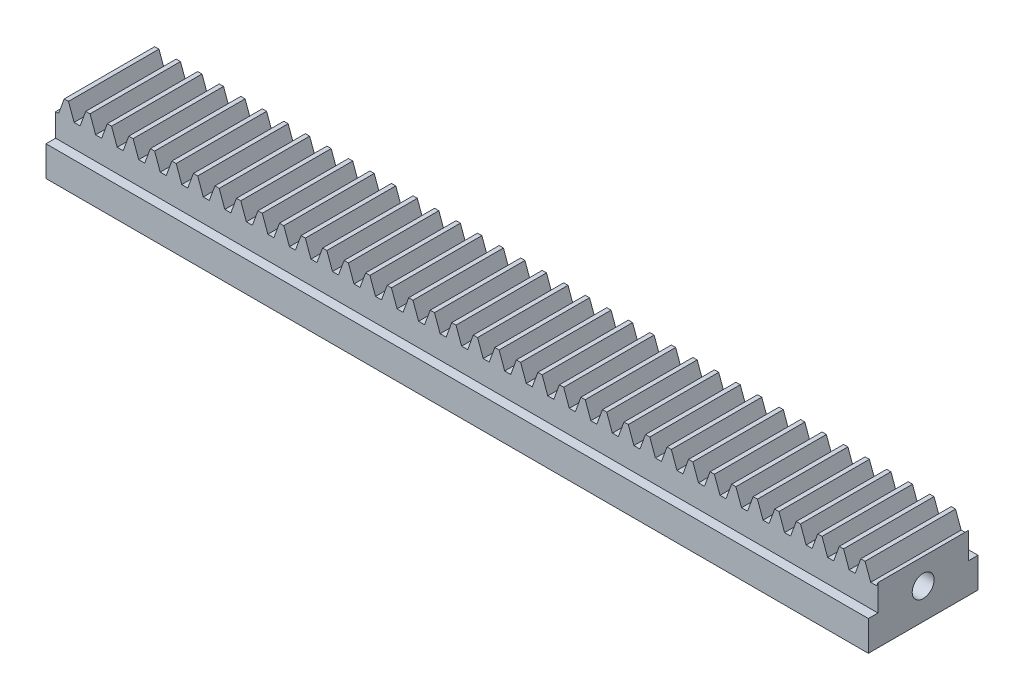
from build123d import *

# Parameters (mm, degrees)
BLANKSKE_W            = 150
BLANKSKE_H            = 12.5
BLANK_DEPTH           = 20
TOOTHCUTSIM_DEPTH     = 152.842846391
TEETHCUTS_COUNT       = 39
TEETHCUTS_PITCH       = 3.926990813
CROQUIS3_W            = 150.577281711
CROQUIS3_H            = 7.352719699
CORTAR_EXTRUIR1_DEPTH = 1.75
CROQUIS4_W            = 150
CROQUIS4_H            = 8.901496228
CORTAR_EXTRUIR2_DEPTH = 1.75
CROQUIS5_R            = 2
CORTAR_EXTRUIR3_DEPTH = 10


with BuildPart() as part:
    # BlankSke → Blank (new body)
    with BuildSketch(Plane.XY):
        with Locations((75, 6.25)):
            Rectangle(BLANKSKE_W, BLANKSKE_H)
    extrude(amount=-BLANK_DEPTH)

    # TooCutSkeSim → ToothCutSim (cut, through all)
    with BuildSketch(Plane.XY):
        Polygon((0.548044212, 9.6875), (-0.548044212, 9.6875), (-1.58095534, 12.5254), (1.58095534, 12.5254), align=None)
    toothcutsim = extrude(amount=-TOOTHCUTSIM_DEPTH, mode=Mode.SUBTRACT)

    # TeethCuts: ToothCutSim ×39
    with Locations(*[(i * TEETHCUTS_PITCH, 0, 0) for i in range(1, TEETHCUTS_COUNT)]):
        add(toothcutsim, mode=Mode.SUBTRACT)

    # Croquis3 → Cortar-Extruir1 (cut)
    with BuildSketch(Plane.XY):
        with Locations((75.288640856, 9.17635985)):
            Rectangle(CROQUIS3_W, CROQUIS3_H)
    extrude(amount=-CORTAR_EXTRUIR1_DEPTH, mode=Mode.SUBTRACT)

    # Croquis4 → Cortar-Extruir2 (cut)
    with BuildSketch(Plane(origin=(0, 0, -20), x_dir=(-1, 0, 0), z_dir=(0, 0, -1))):
        with Locations((-75, 9.950748114)):
            Rectangle(CROQUIS4_W, CROQUIS4_H)
    extrude(amount=-CORTAR_EXTRUIR2_DEPTH, mode=Mode.SUBTRACT)

    # Croquis5 → Cortar-Extruir3 (cut)
    with BuildSketch(Plane(origin=(150, 0, 0), x_dir=(0, 0, -1), z_dir=(1, 0, 0))):
        with Locations((10, 5.648913774)):
            Circle(CROQUIS5_R)
    extrude(amount=-CORTAR_EXTRUIR3_DEPTH, mode=Mode.SUBTRACT)


solid = part.part
